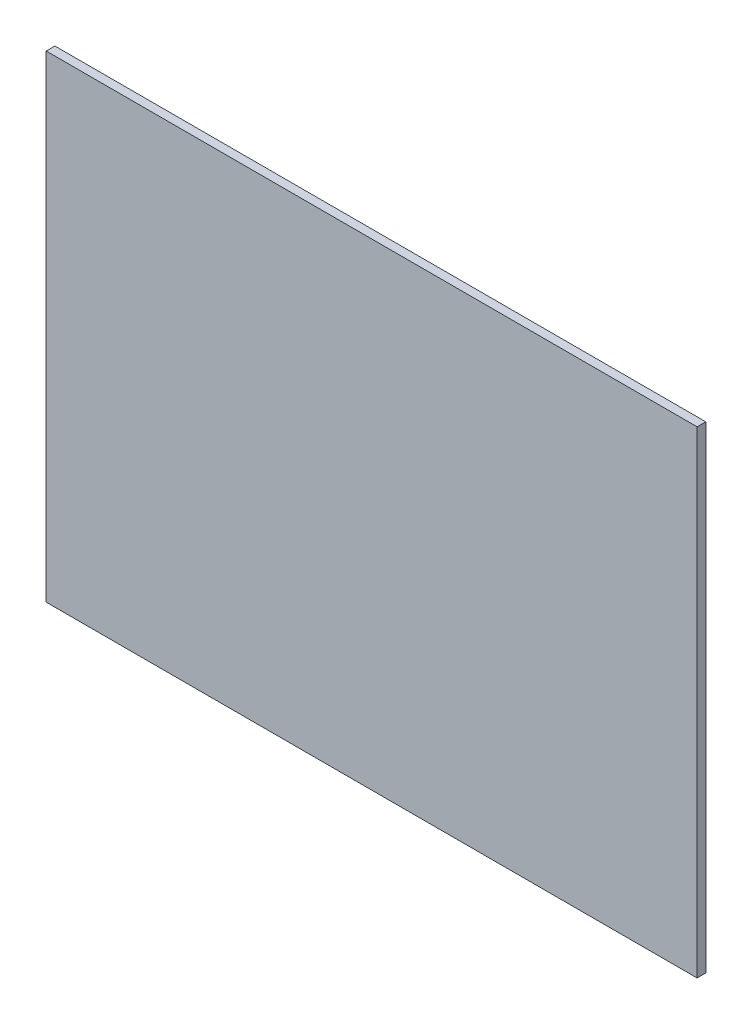
from build123d import *

# Parameters (mm, degrees)
CROQUIS1_W              = 300
CROQUIS1_H              = 220
SALIENTE_EXTRUIR1_DEPTH = 4


with BuildPart() as part:
    # Croquis1 → Saliente-Extruir1 (new body)
    with BuildSketch(Plane.XY):
        with Locations((150, 110)):
            Rectangle(CROQUIS1_W, CROQUIS1_H)
    extrude(amount=SALIENTE_EXTRUIR1_DEPTH)


solid = part.part
